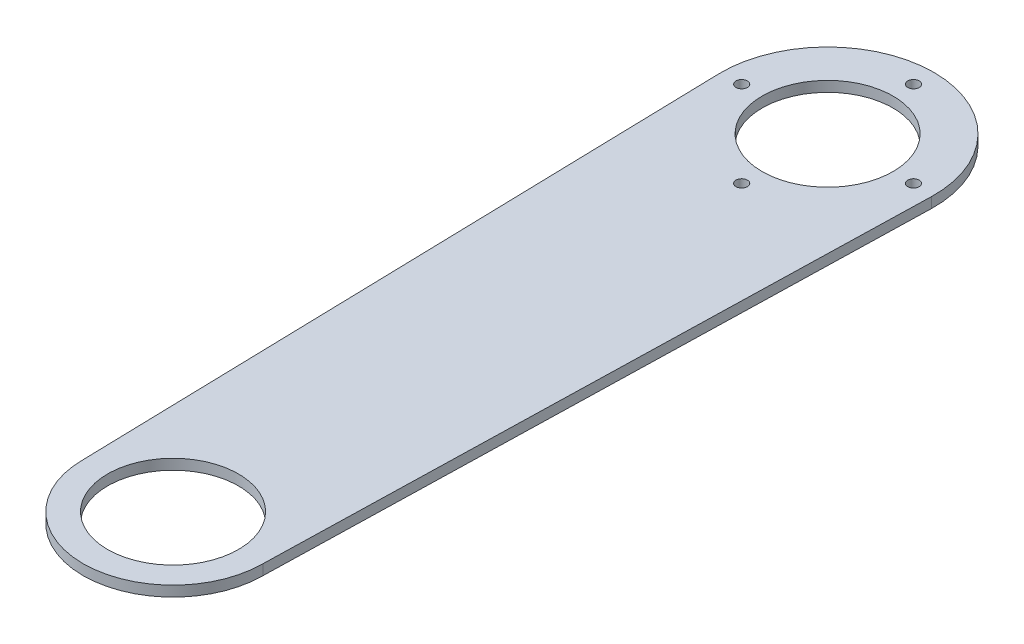
from build123d import *

# Parameters (mm, degrees)
BOSS_EXTRUDE1_DEPTH     = 3.175
SKETCH2_R               = 20
CUT_EXTRUDE1_DEPTH      = 137.464576448
ESQUISSE2_R             = 1.75
ENL_V_MAT_EXTRU_1_DEPTH = 137.464576448


with BuildPart() as part:
    # Sketch1 → Boss-Extrude1 (new body)
    with BuildSketch(Plane(origin=(0, 0, 0), x_dir=(1, 0, 0), z_dir=(0, 1, 0))):
        with BuildLine():
            Line((-27.5, -100), (-32.489807083, 99.186098474))
            ThreePointArc((-32.489807083, 99.186098474), (0, 132.5), (32.489807083, 99.186098474))
            Line((32.489807083, 99.186098474), (27.5, -100))
            ThreePointArc((27.5, -100), (0, -127.5), (-27.5, -100))
        make_face()
    extrude(amount=BOSS_EXTRUDE1_DEPTH)

    # Sketch2 → Cut-Extrude1 (cut, through all)
    with BuildSketch(Plane(origin=(0, 3.175, 0), x_dir=(1, 0, 0), z_dir=(0, 1, 0))):
        with Locations(Location((0, -100, 0), (0, 0, 270))):
            Circle(SKETCH2_R)
        with Locations(Location((0, 100, 0), (0, 0, 270))):
            Circle(SKETCH2_R)
    extrude(amount=-CUT_EXTRUDE1_DEPTH, mode=Mode.SUBTRACT)

    # Esquisse2 → Enlèv. mat.-Extru.1 (cut, through all)
    with BuildSketch(Plane(origin=(0, 3.175, 0), x_dir=(1, 0, 0), z_dir=(0, 1, 0))):
        with Locations(Location((0, 73.75, 0), (0, 0, 270))):
            Circle(ESQUISSE2_R)
        with Locations(Location((26.25, 100, 0), (0, 0, 270))):
            Circle(ESQUISSE2_R)
        with Locations(Location((0, 126.25, 0), (0, 0, 270))):
            Circle(ESQUISSE2_R)
        with Locations(Location((-26.25, 100, 0), (0, 0, 270))):
            Circle(ESQUISSE2_R)
    extrude(amount=-ENL_V_MAT_EXTRU_1_DEPTH, mode=Mode.SUBTRACT)


solid = part.part
